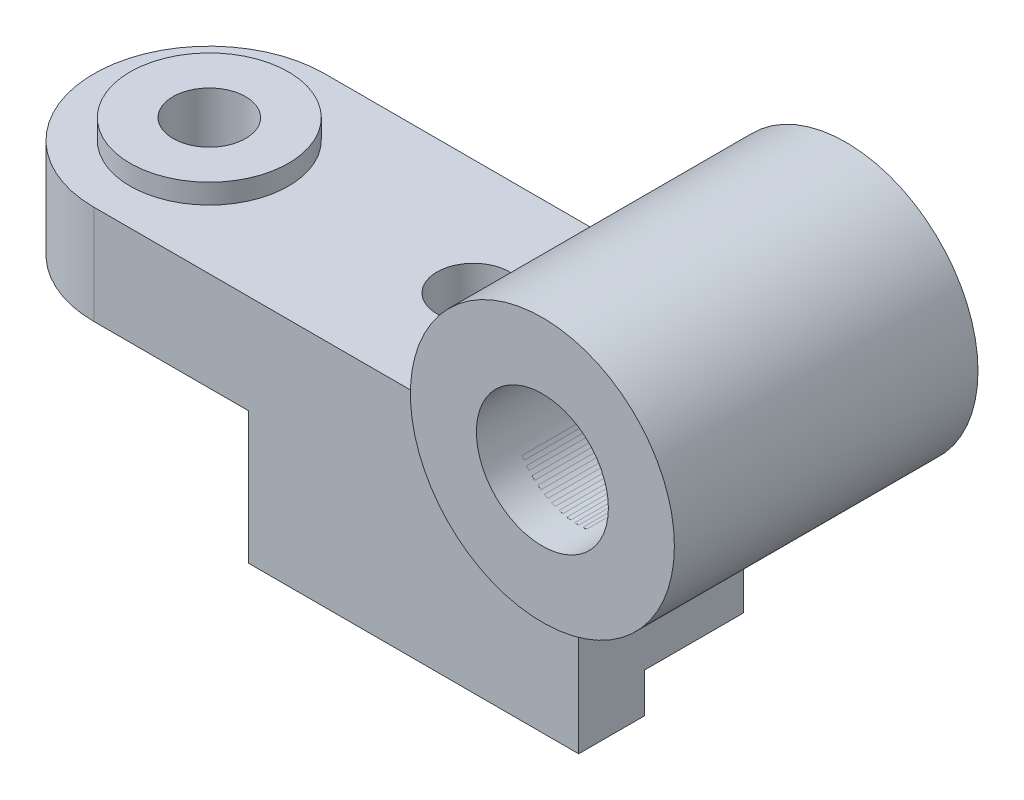
from build123d import *

# Parameters (mm, degrees)
IZIM2_W                     = 50
IZIM2_H                     = 20
Y_KSEKLIK_EKSTR_ZYON1_DEPTH = 10
IZIM5_W                     = 50
IZIM5_H                     = 14
Y_KSEKLIK_EKSTR_ZYON2_DEPTH = 15
IZIM9_R                     = 20
IZIM9_R_2                   = 10
Y_KSEKLIK_EKSTR_ZYON3_DEPTH = 46
Y_KSEKLIK_EKSTR_ZYON4_DEPTH = 15
IZIM10_R                    = 10
KES_EKSTR_ZYON1_DEPTH       = 62
IZIM11_R                    = 12
Y_KSEKLIK_EKSTR_ZYON5_DEPTH = 3
IZIM12_R                    = 5.5
KES_EKSTR_ZYON2_DEPTH       = 33
IZIM13_R                    = 5.5
KES_EKSTR_ZYON3_DEPTH       = 33


with BuildPart() as part:
    # Çizim2 → Yükseklik-Ekstrüzyon1 (new body)
    with BuildSketch(Plane.XY):
        with Locations((-25, -30)):
            Rectangle(IZIM2_W, IZIM2_H)
    extrude(amount=-Y_KSEKLIK_EKSTR_ZYON1_DEPTH)

    # Çizim5 → Yükseklik-Ekstrüzyon2 (add)
    with BuildSketch(Plane(origin=(0, 0, -10), x_dir=(-1, 0, 0), z_dir=(0, 0, -1))):
        with Locations((25, -27)):
            Rectangle(IZIM5_W, IZIM5_H)
    extrude(amount=Y_KSEKLIK_EKSTR_ZYON2_DEPTH)

    # Çizim7 → Yükseklik-Ekstrüzyon4 (add)
    with BuildSketch(Plane(origin=(0, -5, 0), x_dir=(1, 0, 0), z_dir=(0, 1, 0))):
        with BuildLine():
            Line((-73.466007096, 0), (-20, 0))
            Line((-20, 0), (-15.953746438, 0))
            Line((-15.953746438, 0), (1.533992904, 0))
            Line((1.533992904, 0), (1.533992904, 35))
            Line((1.533992904, 35), (-15.953746438, 35))
            Line((-15.953746438, 35), (-20, 35))
            Line((-20, 35), (-73.466007096, 35))
            ThreePointArc((-73.466007096, 35), (-90.966007096, 17.5), (-73.466007096, 0))
        make_face()
    extrude(amount=-Y_KSEKLIK_EKSTR_ZYON4_DEPTH)

    # Çizim10 → Kes-Ekstrüzyon1 (cut)
    with BuildSketch(Plane.XY.offset(5.5)):
        Circle(IZIM10_R)
    extrude(amount=-KES_EKSTR_ZYON1_DEPTH, mode=Mode.SUBTRACT)

    # Çizim11 → Yükseklik-Ekstrüzyon5 (add)
    with BuildSketch(Plane(origin=(0, -5, 0), x_dir=(1, 0, 0), z_dir=(0, 1, 0))):
        with Locations(Location((-73.466007096, 17.5, 0), (0, 0, 180))):
            Circle(IZIM11_R)
    extrude(amount=Y_KSEKLIK_EKSTR_ZYON5_DEPTH)

    # Çizim12 → Kes-Ekstrüzyon2 (cut)
    with BuildSketch(Plane(origin=(0, -2, 0), x_dir=(1, 0, 0), z_dir=(0, 1, 0))):
        with Locations(Location((-73.466007096, 17.5, 0), (0, 0, 180))):
            Circle(IZIM12_R)
    extrude(amount=-KES_EKSTR_ZYON2_DEPTH, mode=Mode.SUBTRACT)

    # Çizim13 → Kes-Ekstrüzyon3 (cut)
    with BuildSketch(Plane(origin=(0, -5, 0), x_dir=(1, 0, 0), z_dir=(0, 1, 0))):
        with Locations(Location((-33.466007096, 17.5, 0), (0, 0, 180))):
            Circle(IZIM13_R)
    extrude(amount=-KES_EKSTR_ZYON3_DEPTH, mode=Mode.SUBTRACT)


with BuildPart() as body_2:
    # Çizim9 → Yükseklik-Ekstrüzyon3 (new body)
    with BuildSketch(Plane.XY.offset(5.5)):
        Circle(IZIM9_R)
        Circle(IZIM9_R_2, mode=Mode.SUBTRACT)
    extrude(amount=-Y_KSEKLIK_EKSTR_ZYON3_DEPTH)


solid = Compound([part.part, body_2.part])
